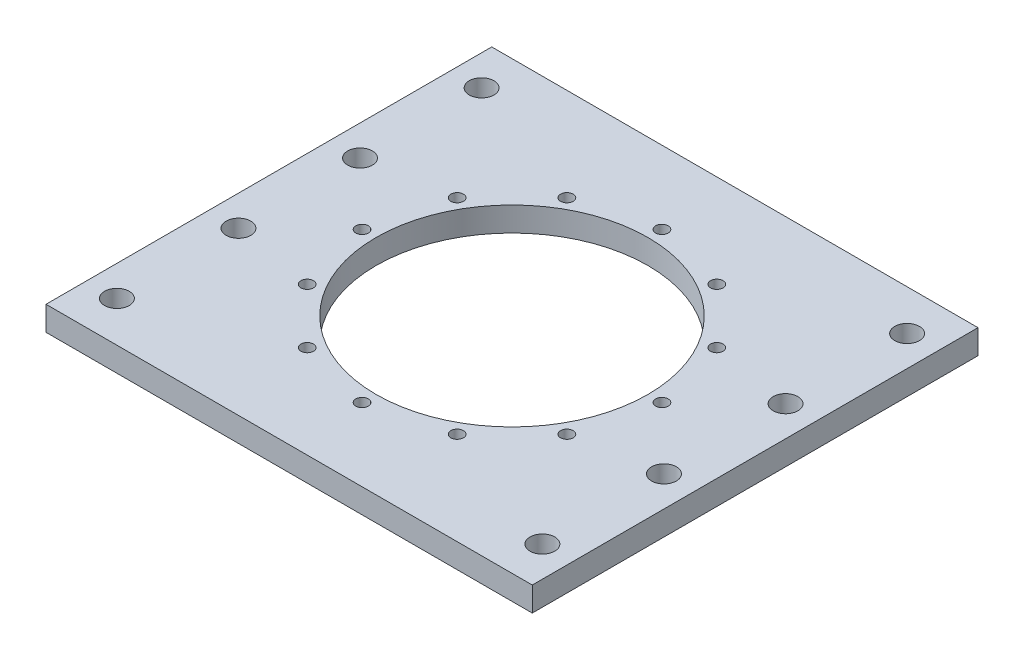
from build123d import *

# Parameters (mm, degrees)
SKETCH1_W            = 120
SKETCH1_H            = 110
BOSS_EXTRUDE1_DEPTH  = 6
SKETCH2_R            = 33.55
CUT_EXTRUDE1_DEPTH   = 82.614949611
M3_CLEARANCE_HOLE1_D = 3.1
CIRPATTERN1_COUNT    = 12
M6_CLEARANCE_HOLE2_D = 6.1


with BuildPart() as part:
    # Sketch1 → Boss-Extrude1 (new body)
    with BuildSketch(Plane(origin=(0, 0, 0), x_dir=(1, 0, 0), z_dir=(0, 1, 0))):
        Rectangle(SKETCH1_W, SKETCH1_H)
    extrude(amount=BOSS_EXTRUDE1_DEPTH)

    # Sketch2 → Cut-Extrude1 (cut, through all)
    with BuildSketch(Plane(origin=(0, 6, 0), x_dir=(1, 0, 0), z_dir=(0, 1, 0))):
        with Locations(Location((0, 0, 0), (0, 0, 270))):
            Circle(SKETCH2_R)
    extrude(amount=-CUT_EXTRUDE1_DEPTH, mode=Mode.SUBTRACT)

    # M3 Clearance Hole1 (through all)
    with Locations(Plane(origin=(0, 6, 0), x_dir=(1, 0, 0), z_dir=(0, 1, 0))):
        with Locations((0, 37)):
            m3_clearance_hole1 = Hole(M3_CLEARANCE_HOLE1_D / 2)

    # CirPattern1: M3 Clearance Hole1 ×12 about axis
    cirpattern1_axis = Axis((0, 0, 0), (0, 1, 0))
    for i in range(1, CIRPATTERN1_COUNT):
        add(m3_clearance_hole1.rotate(cirpattern1_axis, i * 360 / CIRPATTERN1_COUNT), mode=Mode.SUBTRACT)

    # M6 Clearance Hole2 (through all)
    with Locations(Plane(origin=(0, 6, 0), x_dir=(1, 0, 0), z_dir=(0, 1, 0))):
        with Locations((52.5, -45), (52.5, -15), (52.5, 15), (52.5, 45)):
            m6_clearance_hole2 = Hole(M6_CLEARANCE_HOLE2_D / 2)

    # Mirror1: M6 Clearance Hole2 across plane
    add(m6_clearance_hole2.mirror(Plane(origin=(0, 0, 0), x_dir=(0, 0, 1), z_dir=(1, 0, 0))), mode=Mode.SUBTRACT)


solid = part.part
